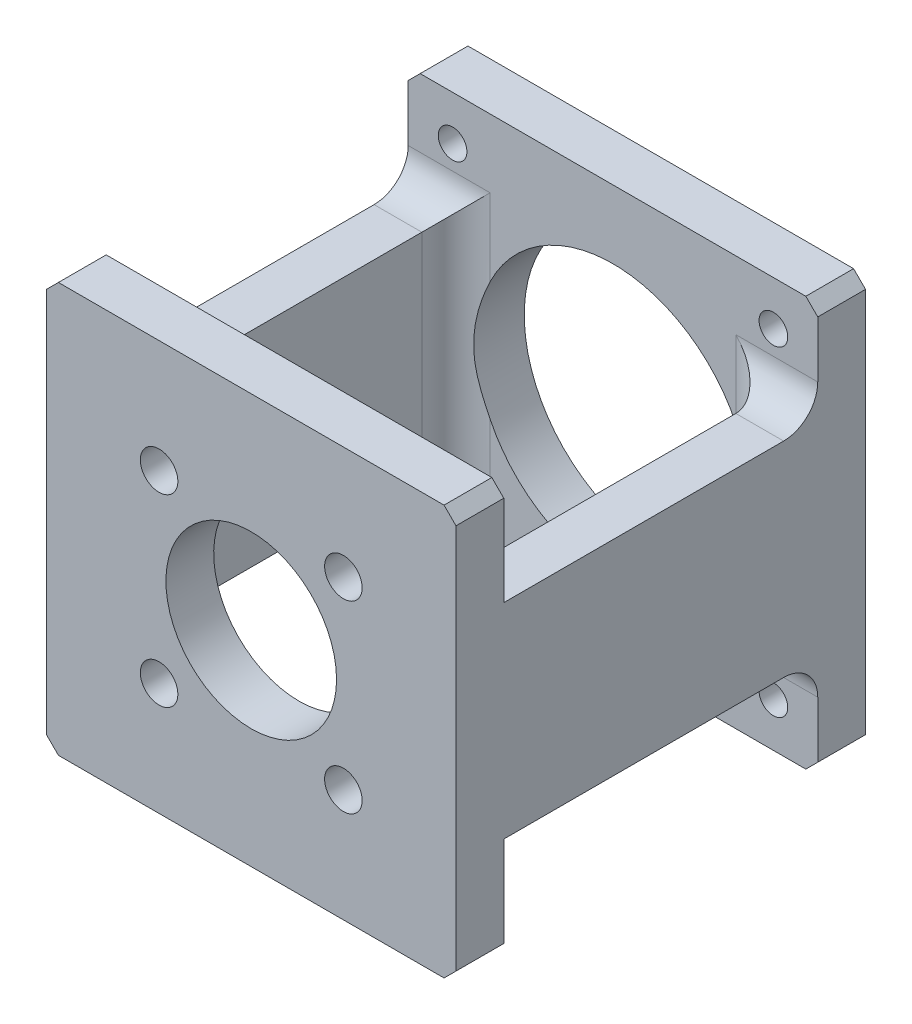
from build123d import *

# Parameters (mm, degrees)
BOSS_EXTRUDE1_DEPTH       = 30
CUT_EXTRUDE1_DEPTH        = 52.961524227
CUT_EXTRUDE1_DEPTH_BACK   = 52.961524227
SKETCH2_W                 = 46
SKETCH2_H                 = 46
FILLET1_R                 = 5
CHAMFER1_SIZE             = 1.75
M5X0_8_TAPPED_HOLE1_D     = 4.2
M5X0_8_TAPPED_HOLE1_DEPTH = 7
M5_CLEARANCE_HOLE1_D      = 5.5
M5_CLEARANCE_HOLE1_DEPTH  = 7
SKETCH11_R                = 12.5
CUT_EXTRUDE2_DEPTH        = 52.961524227
SKETCH12_R                = 20
CUT_EXTRUDE3_DEPTH        = 52.961524227


with BuildPart() as part:
    # Sketch1 → Boss-Extrude1 (new, symmetric)
    with BuildSketch(Plane(origin=(0, 0, 0), x_dir=(0, 0, -1), z_dir=(1, 0, 0))):
        Polygon((-30, -30), (-30, 30), (-23, 30), (-23, 15), (23, 15), (23, 30), (30, 30), (30, -30), (23, -30), (23, -15), (-23, -15), (-23, -30), align=None)
    extrude(amount=BOSS_EXTRUDE1_DEPTH, both=True)

    # Sketch2 → Cut-Extrude1 (cut, two sides: drawn at the far end of the back side and taken through both)
    with BuildSketch(Plane(origin=(0, 0, 0), x_dir=(1, 0, 0), z_dir=(0, 1, 0)).offset(-CUT_EXTRUDE1_DEPTH_BACK)):
        Rectangle(SKETCH2_W, SKETCH2_H)
    extrude(amount=CUT_EXTRUDE1_DEPTH + CUT_EXTRUDE1_DEPTH_BACK, mode=Mode.SUBTRACT)

    # Fillet1
    fillet1_edges = [part.edges().sort_by_distance(p)[0] for p in [
        (26.5, 15, -23),
        (26.5, -15, -23),
        (-26.5, 15, -23),
        (-26.5, -15, -23),
        (-23, 0, -23),
        (23, 0, -23),
    ]]
    fillet(fillet1_edges, radius=FILLET1_R)

    # Chamfer1
    chamfer1_edges = [part.edges().sort_by_distance(p)[0] for p in [
        (-30, 30, 26.5),
        (-30, 30, -26.5),
        (-30, -30, -26.5),
        (-30, -30, 26.5),
        (30, -30, -26.5),
        (30, 30, -26.5),
        (30, 30, 26.5),
        (30, -30, 26.5),
    ]]
    chamfer(chamfer1_edges, length=CHAMFER1_SIZE)

    # M5x0.8 Tapped Hole1
    with Locations(Plane(origin=(0, 0, -30), x_dir=(-1, 0, 0), z_dir=(0, 0, -1))):
        with Locations((-23.5, 23.5), (23.5, 23.5), (23.5, -23.5), (-23.5, -23.5)):
            Hole(M5X0_8_TAPPED_HOLE1_D / 2, depth=M5X0_8_TAPPED_HOLE1_DEPTH)

    # M5 Clearance Hole1
    with Locations(Plane.XY.offset(30)):
        with Locations((-13.5, 13.5), (-13.5, -13.5), (13.5, -13.5), (13.5, 13.5)):
            Hole(M5_CLEARANCE_HOLE1_D / 2, depth=M5_CLEARANCE_HOLE1_DEPTH)

    # Sketch11 → Cut-Extrude2 (cut, through all)
    with BuildSketch(Plane.XY):
        with Locations(Location((0, 0, 0), (0, 0, 270))):
            Circle(SKETCH11_R)
    extrude(amount=CUT_EXTRUDE2_DEPTH, mode=Mode.SUBTRACT)

    # Sketch12 → Cut-Extrude3 (cut, through all)
    with BuildSketch(Plane.XY):
        Circle(SKETCH12_R)
    extrude(amount=-CUT_EXTRUDE3_DEPTH, mode=Mode.SUBTRACT)


solid = part.part
